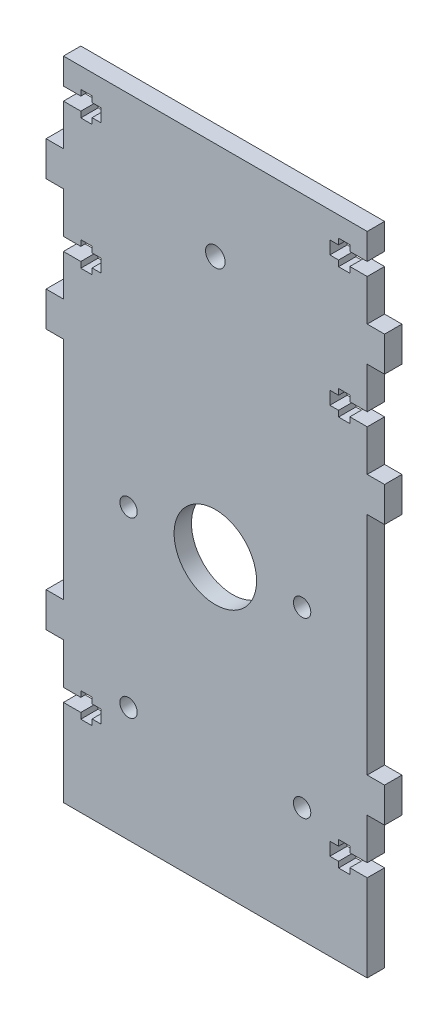
from build123d import *

# Parameters (mm, degrees)
SKETCH_1_R      = 2.25
SKETCH_1_R_2    = 9.5
SKETCH_1_R_3    = 2
EXTRUDE_1_DEPTH = 4


with BuildPart() as part:
    # 草图1 → 凸台-拉伸1 (new body)
    with BuildSketch(Plane.XY):
        Polygon((0, 4.863043478), (-4, 4.863043478), (-4, 12.863043478), (0, 12.863043478), (0, 22.363043478), (4, 22.363043478), (4, 21.013043478), (6.6, 21.013043478), (6.6, 22.363043478), (8.6, 22.363043478), (8.6, 25.363043478), (6.6, 25.363043478), (6.6, 26.713043478), (4, 26.713043478), (4, 25.363043478), (0, 25.363043478), (0, 31.363043478), (70, 31.363043478), (70, 25.363043478), (66, 25.363043478), (66, 26.713043478), (63.4, 26.713043478), (63.4, 25.363043478), (61.4, 25.363043478), (61.4, 22.363043478), (63.4, 22.363043478), (63.4, 21.013043478), (66, 21.013043478), (66, 22.363043478), (70, 22.363043478), (70, 12.863043478), (74, 12.863043478), (74, 4.863043478), (70, 4.863043478), (70, -4.636956522), (66, -4.636956522), (66, -3.286956522), (63.4, -3.286956522), (63.4, -4.636956522), (61.4, -4.636956522), (61.4, -7.636956522), (63.4, -7.636956522), (63.4, -8.986956522), (66, -8.986956522), (66, -7.636956522), (70, -7.636956522), (70, -17.136956522), (74, -17.136956522), (74, -25.136956522), (70, -25.136956522), (70, -77.136956522), (74, -77.136956522), (74, -85.136956522), (70, -85.136956522), (70, -94.636956522), (66, -94.636956522), (66, -93.286956522), (63.4, -93.286956522), (63.4, -94.636956522), (61.4, -94.636956522), (61.4, -97.636956522), (63.4, -97.636956522), (63.4, -98.986956522), (66, -98.986956522), (66, -97.636956522), (70, -97.636956522), (70, -117.636956522), (0, -117.636956522), (0, -97.636956522), (4, -97.636956522), (4, -98.986956522), (6.6, -98.986956522), (6.6, -97.636956522), (8.6, -97.636956522), (8.6, -94.636956522), (6.6, -94.636956522), (6.6, -93.286956522), (4, -93.286956522), (4, -94.636956522), (0, -94.636956522), (0, -85.136956522), (-4, -85.136956522), (-4, -77.136956522), (0, -77.136956522), (0, -25.136956522), (-4, -25.136956522), (-4, -17.136956522), (0, -17.136956522), (0, -7.636956522), (4, -7.636956522), (4, -8.986956522), (6.6, -8.986956522), (6.6, -7.636956522), (8.6, -7.636956522), (8.6, -4.636956522), (6.6, -4.636956522), (6.6, -3.286956522), (4, -3.286956522), (4, -4.636956522), (0, -4.636956522), align=None)
        with Locations((35, 8.863043478)):
            Circle(SKETCH_1_R, mode=Mode.SUBTRACT)
        with Locations((35, -51.136956522)):
            Circle(SKETCH_1_R_2, mode=Mode.SUBTRACT)
        with Locations((55, -51.136956522)):
            Circle(SKETCH_1_R_3, mode=Mode.SUBTRACT)
        with Locations(Location((15, -51.136956522, 0), (0, 0, 180))):
            Circle(SKETCH_1_R_3, mode=Mode.SUBTRACT)
        with Locations((55, -91.136956522)):
            Circle(SKETCH_1_R_3, mode=Mode.SUBTRACT)
        with Locations(Location((15, -91.136956522, 0), (0, 0, 180))):
            Circle(SKETCH_1_R_3, mode=Mode.SUBTRACT)
    extrude(amount=EXTRUDE_1_DEPTH)


solid = part.part
